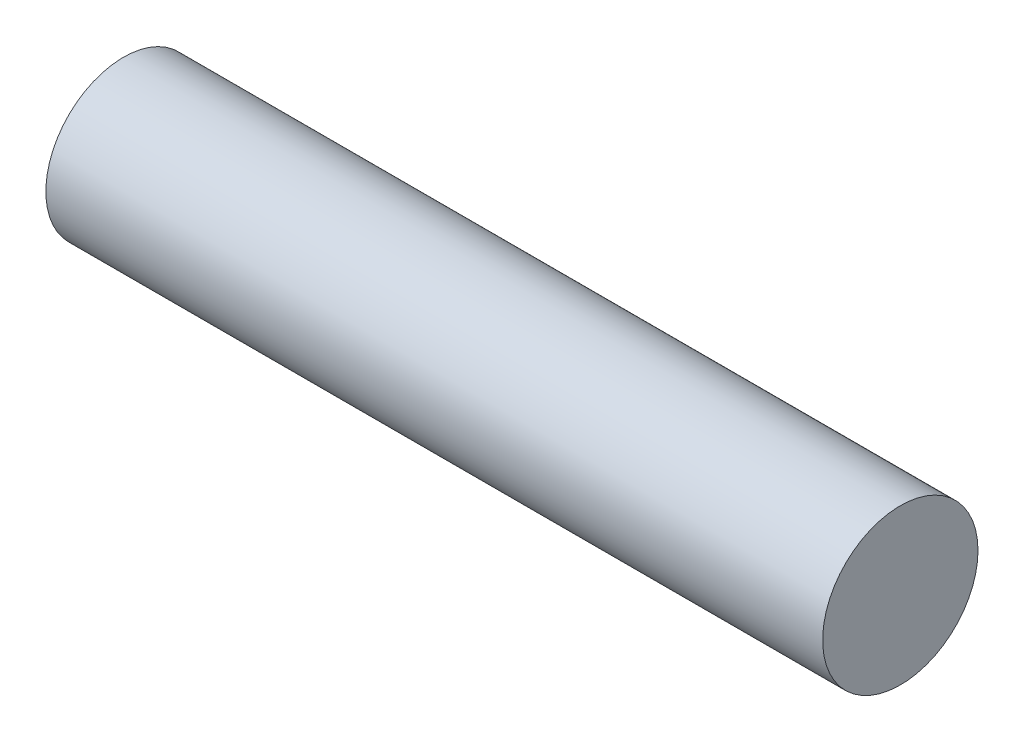
from build123d import *

# Parameters (mm, degrees)
SKETCH1_R           = 5
BOSS_EXTRUDE1_DEPTH = 25


with BuildPart() as part:
    # Sketch1 → Boss-Extrude1 (new, symmetric)
    with BuildSketch(Plane(origin=(0, 0, 0), x_dir=(0, 0, -1), z_dir=(1, 0, 0))):
        Circle(SKETCH1_R)
    extrude(amount=BOSS_EXTRUDE1_DEPTH, both=True)


solid = part.part
